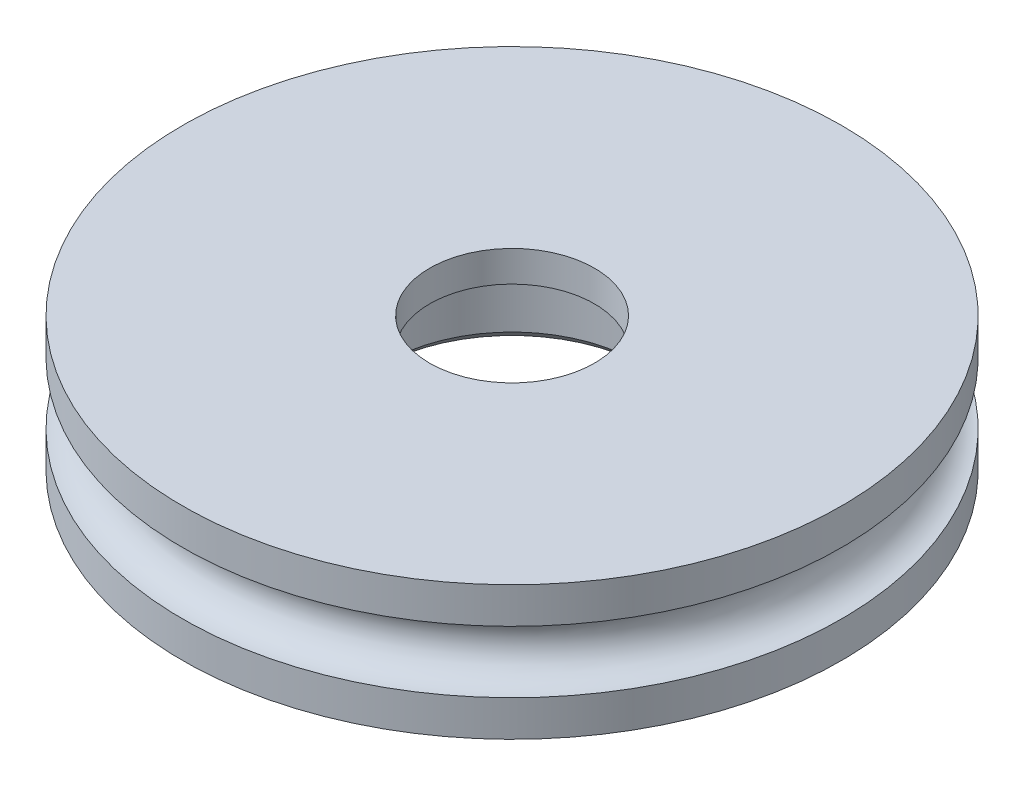
from build123d import *

# Parameters (mm, degrees)
SKETCH1_R           = 8
SKETCH1_R_2         = 3.05
BOSS_EXTRUDE1_DEPTH = 1.625
SKETCH3_R           = 3.5
SKETCH3_R_2         = 2
BOSS_EXTRUDE2_DEPTH = 0.75
SKETCH4_R           = 6.5
SKETCH4_R_2         = 3
CUT_EXTRUDE1_DEPTH  = 0.5
CHAMFER1_SIZE       = 0.25


with BuildPart() as part:
    # Sketch1 → Boss-Extrude1 (new, symmetric)
    with BuildSketch(Plane(origin=(0, 0, 0), x_dir=(1, 0, 0), z_dir=(0, 1, 0))):
        with Locations(Location((0, 0, 0), (0, 0, 90))):
            Circle(SKETCH1_R)
        with Locations(Location((0, 0, 0), (0, 0, 90))):
            Circle(SKETCH1_R_2, mode=Mode.SUBTRACT)
    extrude(amount=BOSS_EXTRUDE1_DEPTH, both=True)

    # Sketch2 → Cut-Revolve1 (revolve, cut)
    with BuildSketch(Plane(origin=(0, 0, 0), x_dir=(0, 0, -1), z_dir=(1, 0, 0)), mode=Mode.PRIVATE) as cut_revolve1_sk:
        with BuildLine():
            Line((-8, 0.75), (-8, -0.75))
            add(Edge.make_bspline(
                [(-8, -0.75), (-7.25, -0.75), (-7.25, 0), (-7.25, 0.75), (-8, 0.75)],
                knots=[1.570796327, 1.570796327, 1.570796327, 3.141592654, 3.141592654, 4.71238898, 4.71238898, 4.71238898], degree=2, weights=[1, 0.707106781, 1, 0.707106781, 1]))
        make_face()
    revolve(cut_revolve1_sk.sketch.rotate(Axis((0, 1.625, 0), (0, -1, 0)), 180), axis=Axis((0, 1.625, 0), (0, -1, 0)), mode=Mode.SUBTRACT)

    # Sketch3 → Boss-Extrude2 (add)
    with BuildSketch(Plane(origin=(0, 1.625, 0), x_dir=(1, 0, 0), z_dir=(0, 1, 0))):
        Circle(SKETCH3_R)
        with Locations(Location((0, 0, 0), (0, 0, 270))):
            Circle(SKETCH3_R_2, mode=Mode.SUBTRACT)
    extrude(amount=-BOSS_EXTRUDE2_DEPTH)

    # Sketch4 → Cut-Extrude1 (cut)
    with BuildSketch(Plane.XZ.offset(1.625)):
        with Locations(Location((0, 0, 0), (0, 0, 270))):
            Circle(SKETCH4_R)
        Circle(SKETCH4_R_2, mode=Mode.SUBTRACT)
    extrude(amount=-CUT_EXTRUDE1_DEPTH, mode=Mode.SUBTRACT)

    # Chamfer1
    chamfer1_edges = [part.edges().sort_by_distance(p)[0] for p in [
        (0, -1.125, 3.05),
    ]]
    chamfer(chamfer1_edges, length=CHAMFER1_SIZE)


solid = part.part
